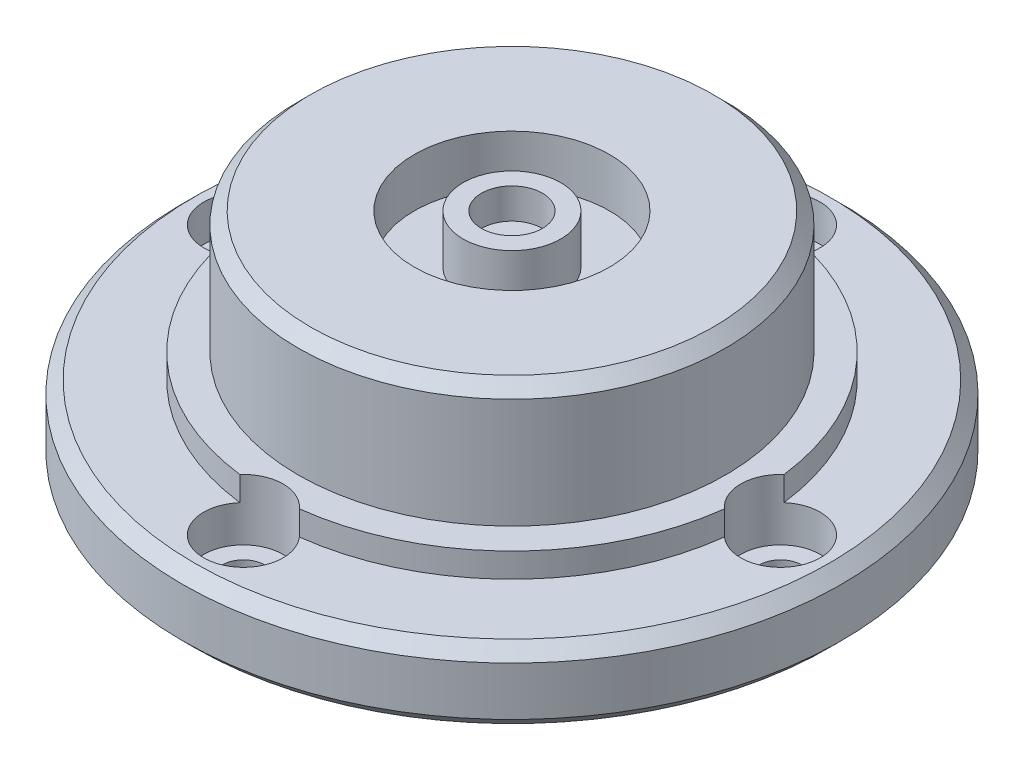
from build123d import *

# Parameters (mm, degrees)
SKETCH_2_R          = 27
EXTRUDE_1_DEPTH     = 18
SKETCH_5_R          = 14.1
CUT_EXTRUDE_1_DEPTH = 5
CUT_EXTRUDE_START   = 6
SKETCH_6_R          = 43.385104725
SKETCH_6_R_2        = 20
CUT_EXTRUDE_2_DEPTH = 37.213741838
CUT_EXTRUDE_START_2 = 8
SKETCH_7_R          = 38.171237221
SKETCH_7_R_2        = 17.5
CUT_EXTRUDE_3_DEPTH = 35.213741838
SKETCH_8_R          = 1.75
CUT_EXTRUDE_4_DEPTH = 43.213741838
CUT_EXTRUDE_START_3 = 3
SKETCH_9_R          = 3.25
CUT_EXTRUDE_5_DEPTH = 40.213741838
CHAMFER1_SIZE       = 1
CHAMFER2_SIZE       = 1
CHAMFER3_SIZE       = 1
CHAMFER4_SIZE       = 1
SKETCH_10_R         = 2.5
CUT_EXTRUDE_6_DEPTH = 2.5
SKETCH_11_R         = 8
SKETCH_11_R_2       = 4
CUT_EXTRUDE_7_DEPTH = 4


with BuildPart() as part:
    # Эскиз2 → Бобышка-Вытянуть1 (new body)
    with BuildSketch(Plane(origin=(0, 0, 0), x_dir=(1, 0, 0), z_dir=(0, 1, 0))):
        with Locations(Location((0, 0, 0), (0, 0, 270))):
            Circle(SKETCH_2_R)
    extrude(amount=EXTRUDE_1_DEPTH)

    # Эскиз5 → Вырез-Вытянуть1 (cut)
    with BuildSketch(Plane(origin=(0, 0, 0), x_dir=(1, 0, 0), z_dir=(0, 1, 0))):
        with Locations(Location((0, 0, 0), (0, 0, 270))):
            Circle(SKETCH_5_R)
    extrude(amount=CUT_EXTRUDE_1_DEPTH, mode=Mode.SUBTRACT)

    # Эскиз6 → Вырез-Вытянуть2 (cut, through all)
    with BuildSketch(Plane(origin=(0, 0, 0), x_dir=(1, 0, 0), z_dir=(0, 1, 0)).offset(CUT_EXTRUDE_START)):
        Circle(SKETCH_6_R)
        with Locations(Location((0, 0, 0), (0, 0, 270))):
            Circle(SKETCH_6_R_2, mode=Mode.SUBTRACT)
    extrude(amount=CUT_EXTRUDE_2_DEPTH, mode=Mode.SUBTRACT)

    # Эскиз7 → Вырез-Вытянуть3 (cut, through all)
    with BuildSketch(Plane(origin=(0, 0, 0), x_dir=(1, 0, 0), z_dir=(0, 1, 0)).offset(CUT_EXTRUDE_START_2)):
        Circle(SKETCH_7_R)
        with Locations(Location((0, 0, 0), (0, 0, 270))):
            Circle(SKETCH_7_R_2, mode=Mode.SUBTRACT)
    extrude(amount=CUT_EXTRUDE_3_DEPTH, mode=Mode.SUBTRACT)

    # Эскиз8 → Вырез-Вытянуть4 (cut, through all)
    with BuildSketch(Plane(origin=(0, 0, 0), x_dir=(1, 0, 0), z_dir=(0, 1, 0))):
        with Locations(Location((0, 22, 0), (0, 0, 270))):
            Circle(SKETCH_8_R)
        with Locations(Location((22, 0, 0), (0, 0, 270))):
            Circle(SKETCH_8_R)
        with Locations(Location((0, -22, 0), (0, 0, 270))):
            Circle(SKETCH_8_R)
        with Locations(Location((-22, 0, 0), (0, 0, 270))):
            Circle(SKETCH_8_R)
    extrude(amount=CUT_EXTRUDE_4_DEPTH, mode=Mode.SUBTRACT)

    # Эскиз9 → Вырез-Вытянуть5 (cut, through all)
    with BuildSketch(Plane(origin=(0, 0, 0), x_dir=(1, 0, 0), z_dir=(0, 1, 0)).offset(CUT_EXTRUDE_START_3)):
        with Locations(Location((0, 22, 0), (0, 0, 318.602722353))):
            Circle(SKETCH_9_R)
        with Locations(Location((22, 0, 0), (0, 0, 131.397277647))):
            Circle(SKETCH_9_R)
        with Locations(Location((0, -22, 0), (0, 0, 138.602722353))):
            Circle(SKETCH_9_R)
        with Locations(Location((-22, 0, 0), (0, 0, 48.602722353))):
            Circle(SKETCH_9_R)
    extrude(amount=CUT_EXTRUDE_5_DEPTH, mode=Mode.SUBTRACT)

    # Chamfer1
    chamfer1_edges = [part.edges().sort_by_distance(p)[0] for p in [
        (0, 0, -14.1),
    ]]
    chamfer(chamfer1_edges, length=CHAMFER1_SIZE)

    # Chamfer2
    chamfer2_edges = [part.edges().sort_by_distance(p)[0] for p in [
        (0, 18, -17.5),
    ]]
    chamfer(chamfer2_edges, length=CHAMFER2_SIZE)

    # Chamfer3
    chamfer3_edges = [part.edges().sort_by_distance(p)[0] for p in [
        (0, 0, -27),
    ]]
    chamfer(chamfer3_edges, length=CHAMFER3_SIZE)

    # Chamfer4
    chamfer4_edges = [part.edges().sort_by_distance(p)[0] for p in [
        (0, 6, -27),
    ]]
    chamfer(chamfer4_edges, length=CHAMFER4_SIZE)

    # Эскиз10 → Вырез-Вытянуть6 (cut)
    with BuildSketch(Plane(origin=(0, 18, 0), x_dir=(1, 0, 0), z_dir=(0, 1, 0))):
        with Locations(Location((0, 0, 0), (0, 0, 270))):
            Circle(SKETCH_10_R)
    extrude(amount=-CUT_EXTRUDE_6_DEPTH, mode=Mode.SUBTRACT)

    # Эскиз11 → Вырез-Вытянуть7 (cut)
    with BuildSketch(Plane(origin=(0, 18, 0), x_dir=(1, 0, 0), z_dir=(0, 1, 0))):
        with Locations(Location((0, 0, 0), (0, 0, 270))):
            Circle(SKETCH_11_R)
        with Locations(Location((0, 0, 0), (0, 0, 270))):
            Circle(SKETCH_11_R_2, mode=Mode.SUBTRACT)
    extrude(amount=-CUT_EXTRUDE_7_DEPTH, mode=Mode.SUBTRACT)


solid = part.part
